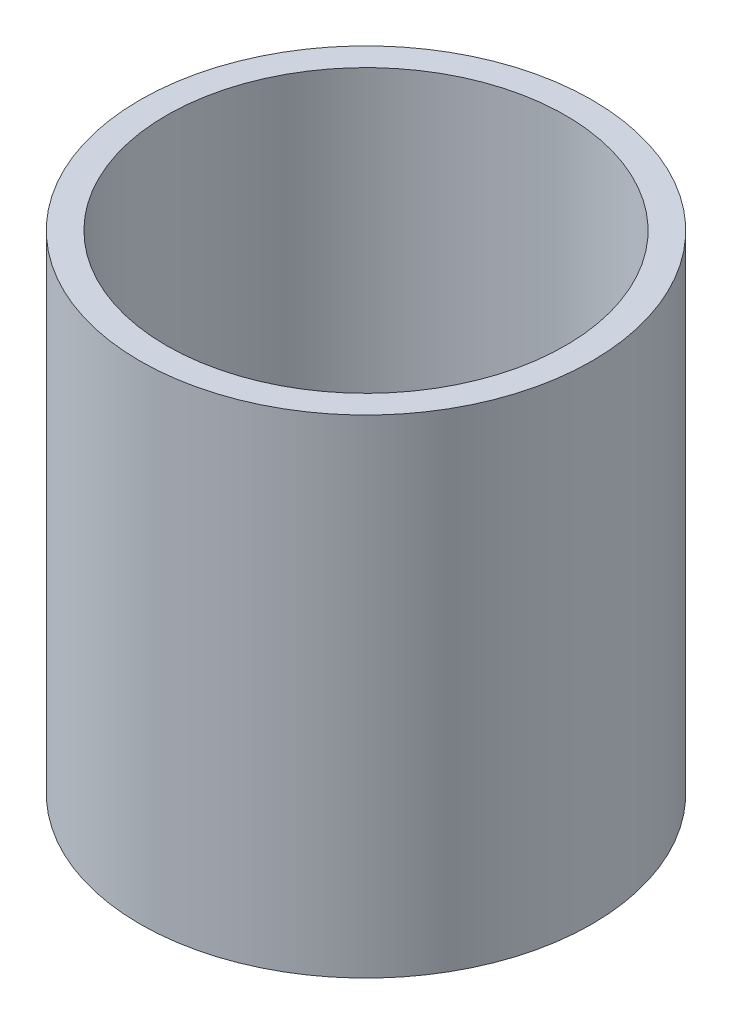
from build123d import *

# Parameters (mm, degrees)
SKETCH1_R           = 25.5
SKETCH1_R_2         = 22.5
BOSS_EXTRUDE1_DEPTH = 55


with BuildPart() as part:
    # Sketch1 → Boss-Extrude1 (new body)
    with BuildSketch(Plane(origin=(0, 0, 0), x_dir=(1, 0, 0), z_dir=(0, 1, 0))):
        with Locations(Location((0, 0, 0), (0, 0, 270))):
            Circle(SKETCH1_R)
        with Locations(Location((0, 0, 0), (0, 0, 270))):
            Circle(SKETCH1_R_2, mode=Mode.SUBTRACT)
    extrude(amount=BOSS_EXTRUDE1_DEPTH)


solid = part.part
